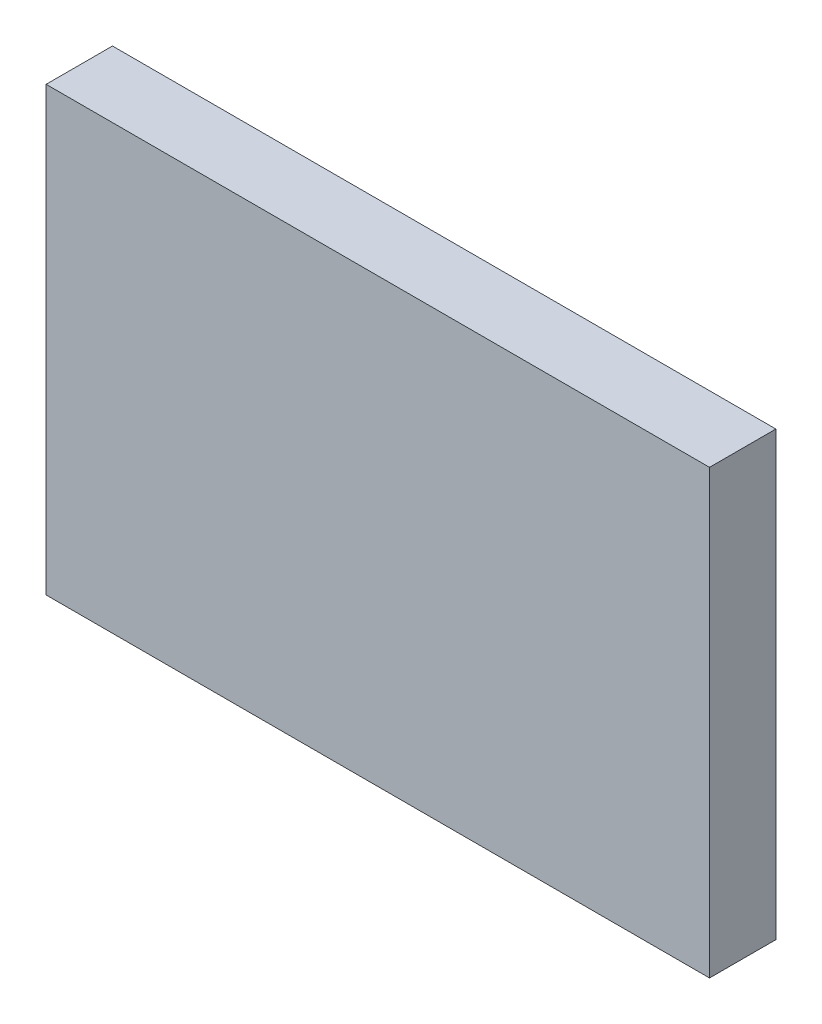
from build123d import *

# Parameters (mm, degrees)
CROQUIS1_W              = 150
CROQUIS1_H              = 100
SALIENTE_EXTRUIR1_DEPTH = 15


with BuildPart() as part:
    # Croquis1 → Saliente-Extruir1 (new body)
    with BuildSketch(Plane.XY):
        Rectangle(CROQUIS1_W, CROQUIS1_H)
    extrude(amount=SALIENTE_EXTRUIR1_DEPTH)


solid = part.part
